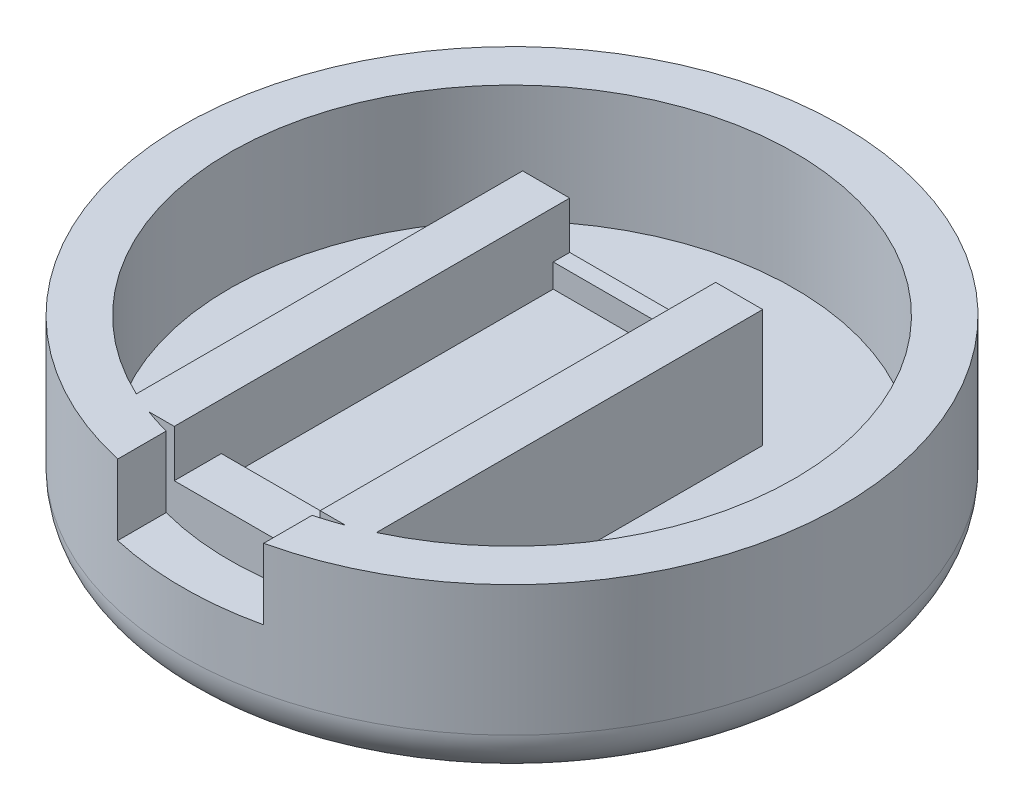
from build123d import *

# Parameters (mm, degrees)
SKETCH1_W           = 10.2
SKETCH1_H           = 16.8
SKETCH1_W_2         = 6.2
SKETCH1_H_2         = 14.1
BOSS_EXTRUDE1_DEPTH = 3
SKETCH2_W           = 6.2
SKETCH2_H           = 2
CUT_EXTRUDE1_DEPTH  = 25.4
SKETCH3_W           = 10.2
SKETCH3_H           = 16.8
BOSS_EXTRUDE2_DEPTH = 2
SKETCH4_R           = 14
SKETCH4_R_2         = 12
BOSS_EXTRUDE4_DEPTH = 5
BOSS_EXTRUDE5_START = 2.54
SKETCH5_R           = 14
BOSS_EXTRUDE5_DEPTH = 2.54
SKETCH6_W           = 6.2
SKETCH6_H           = 3
CUT_EXTRUDE2_DEPTH  = 7.62
FILLET1_R           = 2


with BuildPart() as part:
    # Sketch1 → Boss-Extrude1 (new body)
    with BuildSketch(Plane(origin=(0, 0, 0), x_dir=(1, 0, 0), z_dir=(0, 1, 0))):
        with Locations((-29.627149571, -6.071905286)):
            Rectangle(SKETCH1_W, SKETCH1_H)
        with Locations((-29.627149571, -5.421905286)):
            Rectangle(SKETCH1_W_2, SKETCH1_H_2, mode=Mode.SUBTRACT)
    extrude(amount=BOSS_EXTRUDE1_DEPTH)

    # Sketch2 → Cut-Extrude1 (cut)
    with BuildSketch(Plane.XY.offset(14.471905286)):
        with Locations((-29.627149571, 2)):
            Rectangle(SKETCH2_W, SKETCH2_H)
    extrude(amount=-CUT_EXTRUDE1_DEPTH, mode=Mode.SUBTRACT)

    # Sketch3 → Boss-Extrude2 (add)
    with BuildSketch(Plane.XZ):
        with Locations((-29.627149571, 6.071905286)):
            Rectangle(SKETCH3_W, SKETCH3_H)
    extrude(amount=BOSS_EXTRUDE2_DEPTH)

    # Sketch4 → Boss-Extrude4 (add)
    with BuildSketch(Plane.XZ.offset(2)):
        with Locations(Location((-29.627149571, 3.222245286, 0), (0, 0, 270))):
            Circle(SKETCH4_R)
        with Locations((-29.627149571, 3.222245286)):
            Circle(SKETCH4_R_2, mode=Mode.SUBTRACT)
    extrude(amount=-BOSS_EXTRUDE4_DEPTH)

    # Sketch5 → Boss-Extrude5 (add)
    with BuildSketch(Plane.XZ.offset(2).offset(BOSS_EXTRUDE5_START)):
        with Locations(Location((-29.627149571, 3.222245286, 0), (0, 0, 270))):
            Circle(SKETCH5_R)
    extrude(amount=-BOSS_EXTRUDE5_DEPTH)

    # Sketch6 → Cut-Extrude2 (cut)
    with BuildSketch(Plane.XY.offset(14.471905286)):
        with Locations((-29.627149571, 1.5)):
            Rectangle(SKETCH6_W, SKETCH6_H)
    extrude(amount=CUT_EXTRUDE2_DEPTH, mode=Mode.SUBTRACT)

    # Fillet1
    fillet1_edges = [part.edges().sort_by_distance(p)[0] for p in [
        (-29.627149571, -4.54, 17.222245286),
    ]]
    fillet(fillet1_edges, radius=FILLET1_R)


solid = part.part
